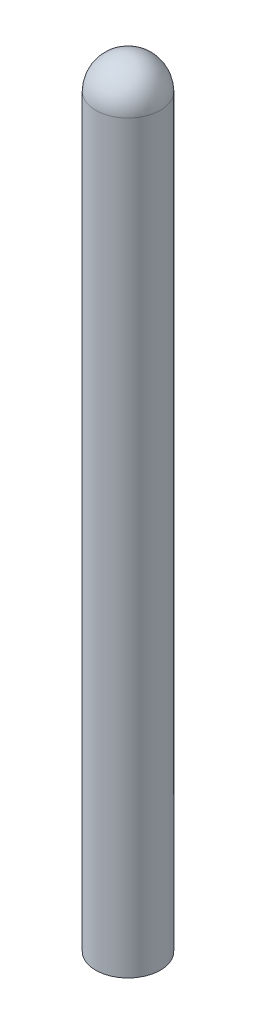
from build123d import *

# Parameters (mm, degrees)
SKETCH2_R           = 3.175
BOSS_EXTRUDE1_DEPTH = 76.2
FILLET1_R           = 3.175


with BuildPart() as part:
    # Sketch2 → Boss-Extrude1 (new body)
    with BuildSketch(Plane(origin=(0, 0, 0), x_dir=(1, 0, 0), z_dir=(0, 1, 0))):
        with Locations(Location((0, 0, 0), (0, 0, 90))):
            Circle(SKETCH2_R)
    extrude(amount=BOSS_EXTRUDE1_DEPTH)

    # Fillet1
    fillet1_edges = [part.edges().sort_by_distance(p)[0] for p in [
        (0, 76.2, 3.175),
    ]]
    fillet(fillet1_edges, radius=FILLET1_R)


solid = part.part
